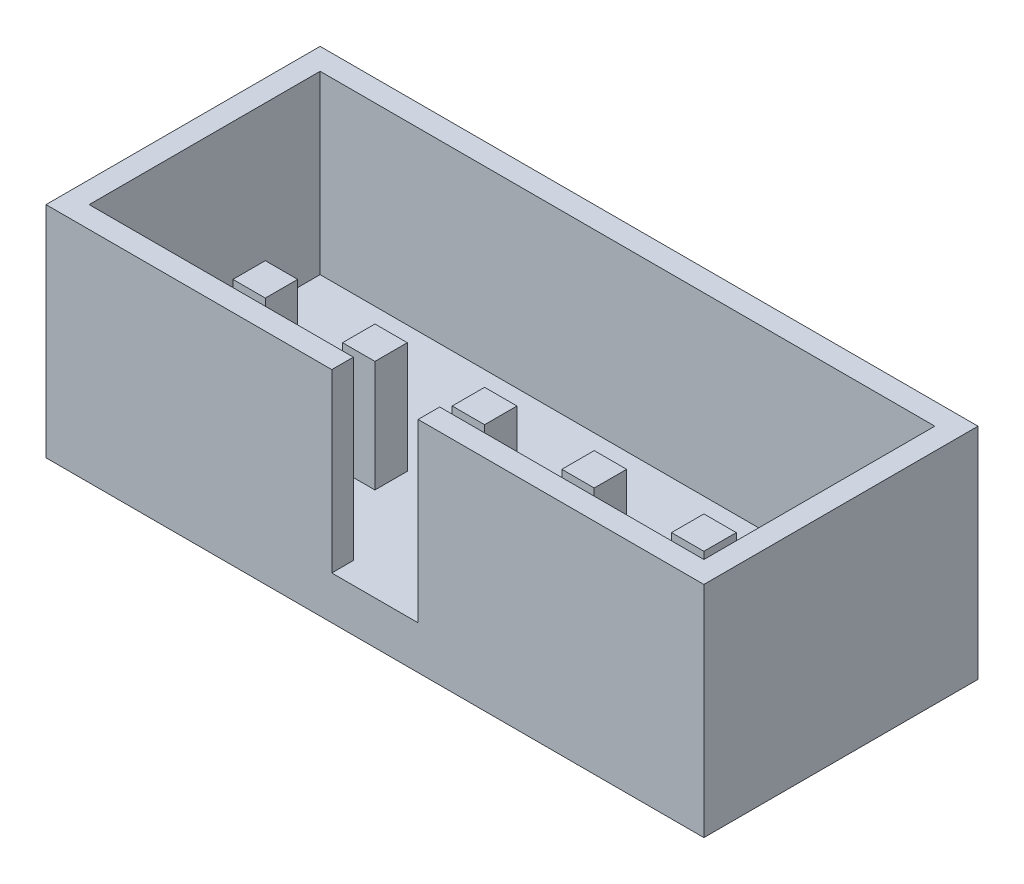
from build123d import *

# Parameters (mm, degrees)
SKETCH_1_W           = 15.24
SKETCH_1_H           = 6.35
EXTRUDE_1_DEPTH      = 5.08
SKETCH_2_W           = 14.24
SKETCH_2_H           = 5.35
CUT_EXTRUDE_1_DEPTH  = 4.08
SKETCH_3_W           = 2
SKETCH_3_H           = 4.08
CUT_EXTRUDE_2_DEPTH  = 1
EXTRUDE_2_DEPTH      = 2
EXTRUDE_2_DEPTH_BACK = 3.58
SKETCH_4_W           = 0.75
SKETCH_4_H           = 0.75


with BuildPart() as part:
    # 草图1 → 拉伸1 (new body)
    with BuildSketch(Plane(origin=(0, 0, 0), x_dir=(1, 0, 0), z_dir=(0, 1, 0))):
        Rectangle(SKETCH_1_W, SKETCH_1_H)
    extrude(amount=EXTRUDE_1_DEPTH)

    # 草图2 → 切除-拉伸1 (cut)
    with BuildSketch(Plane(origin=(0, 5.08, 0), x_dir=(-1, 0, 0), z_dir=(0, 1, 0))):
        Rectangle(SKETCH_2_W, SKETCH_2_H)
    extrude(amount=-CUT_EXTRUDE_1_DEPTH, mode=Mode.SUBTRACT)

    # 草图3 → 切除-拉伸2 (cut)
    with BuildSketch(Plane.XY.offset(3.175)):
        with Locations((0, 3.04)):
            Rectangle(SKETCH_3_W, SKETCH_3_H)
    extrude(amount=-CUT_EXTRUDE_2_DEPTH, mode=Mode.SUBTRACT)

    # 草图4 → 拉伸2 (add, two sides: drawn at the far end of the back side and taken through both)
    with BuildSketch(Plane.XZ.offset(-EXTRUDE_2_DEPTH_BACK)):
        with Locations((-2.54, 0.635)):
            Rectangle(SKETCH_4_W, SKETCH_4_H)
        with Locations((0, 0.635)):
            Rectangle(SKETCH_4_W, SKETCH_4_H)
        with Locations((2.54, 0.635)):
            Rectangle(SKETCH_4_W, SKETCH_4_H)
        with Locations((-5.08, 0.635)):
            Rectangle(SKETCH_4_W, SKETCH_4_H)
        with Locations((5.08, 0.635)):
            Rectangle(SKETCH_4_W, SKETCH_4_H)
    extrude(amount=EXTRUDE_2_DEPTH + EXTRUDE_2_DEPTH_BACK)


solid = part.part
